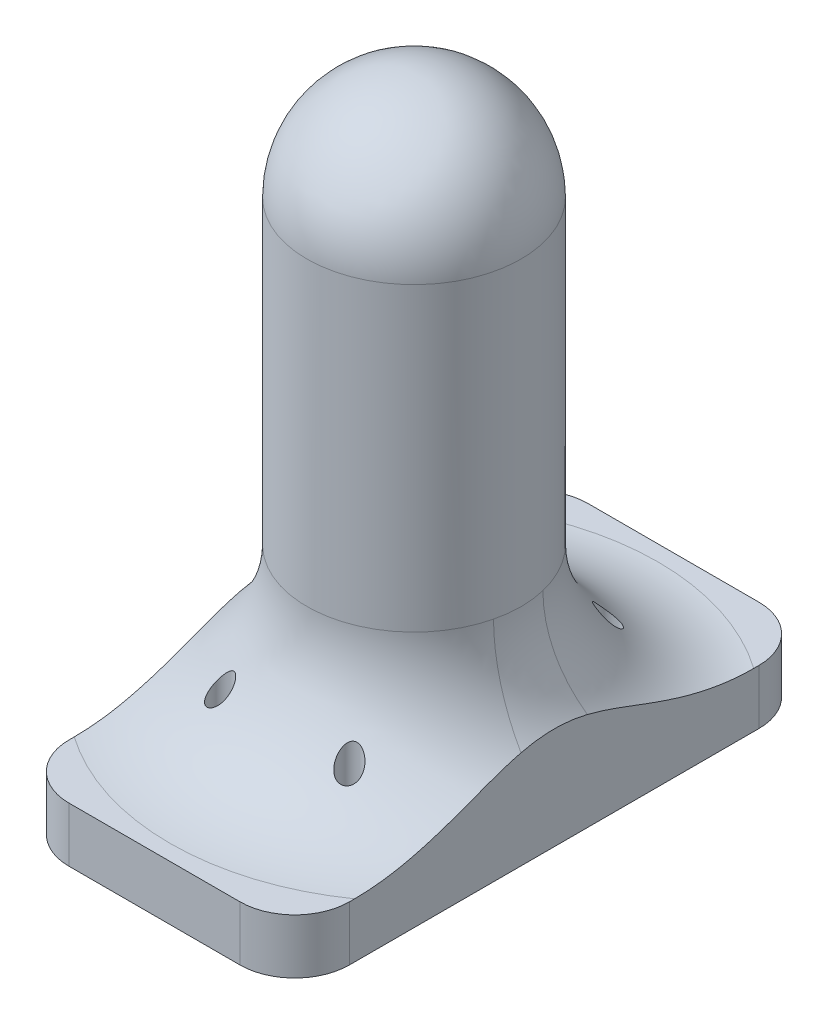
from build123d import *

# Parameters (mm, degrees)
SKETCH1_W                    = 44.069
SKETCH1_H                    = 48.18617301
BOSS_EXTRUDE1_DEPTH          = 5.08
SKETCH2_R                    = 9.9441
BOSS_EXTRUDE2_DEPTH          = 40.64
REVOLVE1_ANGLE               = 180
FILLET1_R                    = 12.7
CUT_EXTRUDE1_DEPTH           = 65.532844704
M2_5X0_45_TAPPED_HOLE1_D     = 2.05
M2_5X0_45_TAPPED_HOLE1_DEPTH = 12
M2_5X0_45_TAPPED_HOLE1_TIP   = 0.615882135
CUT_EXTRUDE2_DEPTH           = 10


with BuildPart() as part:
    # Sketch1 → Boss-Extrude1 (new body)
    with BuildSketch(Plane(origin=(0, 0, 0), x_dir=(1, 0, 0), z_dir=(0, 1, 0))):
        Rectangle(SKETCH1_W, SKETCH1_H)
    extrude(amount=BOSS_EXTRUDE1_DEPTH)

    # Sketch2 → Boss-Extrude2 (add)
    with BuildSketch(Plane(origin=(0, 5.08, 0), x_dir=(1, 0, 0), z_dir=(0, 1, 0))):
        with Locations(Location((0, 0, 0), (0, 0, 270))):
            Circle(SKETCH2_R)
    extrude(amount=BOSS_EXTRUDE2_DEPTH)

    # Sketch3 → Revolve1 (revolve)
    with BuildSketch(Plane(origin=(0, 45.72, 0), x_dir=(1, 0, 0), z_dir=(0, 1, 0))):
        with BuildLine():
            Line((0, 9.9441), (0, -9.9441))
            ThreePointArc((0, -9.9441), (9.9441, 0), (0, 9.9441))
        make_face()
    revolve(axis=Axis((0, 45.72, -9.9441), (0, 0, 1)), revolution_arc=REVOLVE1_ANGLE)

    # Fillet1
    fillet1_edges = [part.edges().sort_by_distance(p)[0] for p in [
        (0, 5.08, -9.9441),
    ]]
    fillet(fillet1_edges, radius=FILLET1_R)

    # Sketch4 → Cut-Extrude1 (cut, through all)
    with BuildSketch(Plane.XZ):
        with BuildLine():
            Line((-22.0345, -24.093086505), (-7.9375, -24.093086505))
            ThreePointArc((-7.9375, -24.093086505), (-11.529602448, -22.605188954), (-13.0175, -19.013086505))
            Line((-13.0175, -19.013086505), (-13.0175, 19.013086505))
            ThreePointArc((-13.0175, 19.013086505), (-11.529602448, 22.605188954), (-7.9375, 24.093086505))
            Line((-7.9375, 24.093086505), (-22.0345, 24.093086505))
            Line((-22.0345, 24.093086505), (-22.0345, -24.093086505))
        make_face()
        with BuildLine():
            ThreePointArc((13.0175, -19.013086505), (11.529602448, -22.605188954), (7.9375, -24.093086505))
            Line((7.9375, -24.093086505), (22.0345, -24.093086505))
            Line((22.0345, -24.093086505), (22.0345, 24.093086505))
            Line((22.0345, 24.093086505), (7.9375, 24.093086505))
            ThreePointArc((7.9375, 24.093086505), (11.529602448, 22.605188954), (13.0175, 19.013086505))
            Line((13.0175, 19.013086505), (13.0175, -19.013086505))
        make_face()
    extrude(amount=-CUT_EXTRUDE1_DEPTH, mode=Mode.SUBTRACT)

    # M2.5x0.45 Tapped Hole1
    with Locations(Plane(origin=(0, 0, 0), x_dir=(-1, 0, 0), z_dir=(0, -1, 0))):
        with Locations((-6.00000248, -11.999988915), (-3.50000248, -7.999988915), (-8.00000248, -3.499988915), (-8.00000248, 3.500011085), (-3.50000248, 8.000011085), (-6.00000248, 12.000011085), (3.49999752, 8.000011085), (5.99999752, 12.000011085), (7.99999752, 3.500011085), (7.99999752, -3.499988915), (3.49999752, -7.999988915), (5.99999752, -11.999988915)):
            Hole(M2_5X0_45_TAPPED_HOLE1_D / 2, depth=M2_5X0_45_TAPPED_HOLE1_DEPTH)
            with Locations((0, 0, -(M2_5X0_45_TAPPED_HOLE1_DEPTH + M2_5X0_45_TAPPED_HOLE1_TIP / 2))):  # 118° drill point
                Cone(0, M2_5X0_45_TAPPED_HOLE1_D / 2, M2_5X0_45_TAPPED_HOLE1_TIP, mode=Mode.SUBTRACT)

    # Sketch5 → Cut-Extrude2 (cut)
    with BuildSketch(Plane.XZ):
        with BuildLine():
            ThreePointArc((2.48e-06, -4.200011085), (4.20000248, -1.1085e-05), (2.48e-06, 4.199988915))
            ThreePointArc((2.48e-06, 4.199988915), (-4.19999752, -1.1085e-05), (2.48e-06, -4.200011085))
        make_face()
    extrude(amount=-CUT_EXTRUDE2_DEPTH, mode=Mode.SUBTRACT)


solid = part.part
